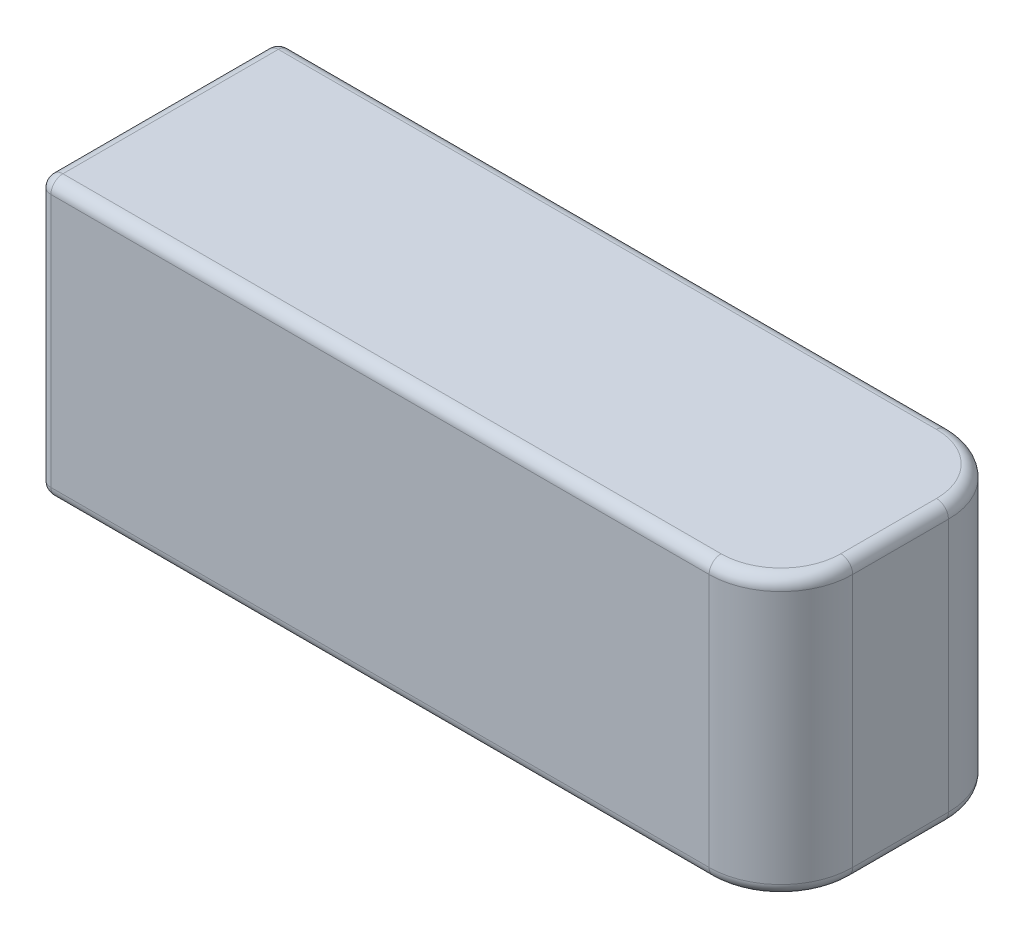
from build123d import *

# Parameters (mm, degrees)
SKETCH1_W           = 155
SKETCH1_H           = 50
BOSS_EXTRUDE1_DEPTH = 58
FILLET1_R           = 15
FILLET2_R           = 2.5


with BuildPart() as part:
    # Sketch1 → Boss-Extrude1 (new body)
    with BuildSketch(Plane(origin=(0, 0, 0), x_dir=(1, 0, 0), z_dir=(0, 1, 0))):
        Rectangle(SKETCH1_W, SKETCH1_H)
    extrude(amount=BOSS_EXTRUDE1_DEPTH)

    # Fillet1
    fillet1_edges = [part.edges().sort_by_distance(p)[0] for p in [
        (77.5, 29, -25),
        (77.5, 29, 25),
    ]]
    fillet(fillet1_edges, radius=FILLET1_R)

    # Fillet2
    fillet2_edges = [part.edges().sort_by_distance(p)[0] for p in [
        (-7.5, 0, -25),
        (-7.5, 58, -25),
        (77.5, 0, 0),
        (73.106601718, 0, 20.606601718),
        (73.106601718, 0, -20.606601718),
        (77.5, 58, 0),
        (73.106601718, 58, 20.606601718),
        (73.106601718, 58, -20.606601718),
        (-77.5, 58, 0),
        (-7.5, 0, 25),
        (-77.5, 0, 0),
        (-77.5, 29, -25),
        (-77.5, 29, 25),
        (-7.5, 58, 25),
    ]]
    fillet(fillet2_edges, radius=FILLET2_R)


solid = part.part
